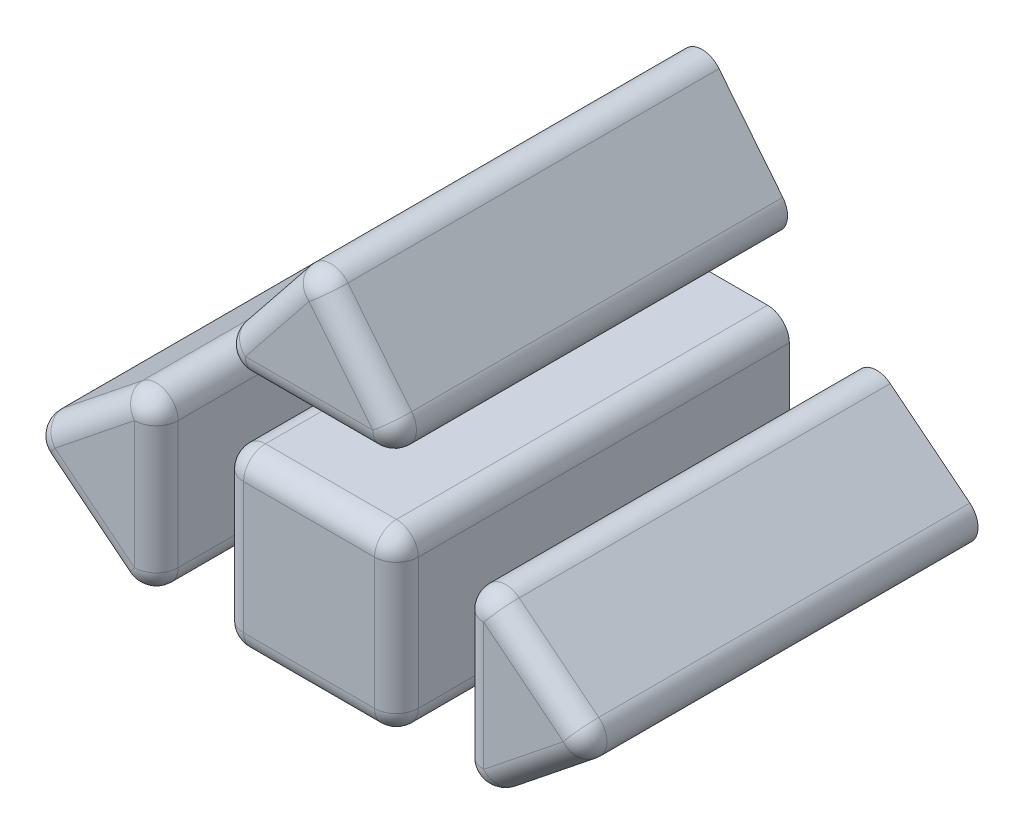
from build123d import *

# Parameters (mm, degrees)
BOSS_EXTRUDE1_DEPTH   = 18
BOSS_EXTRUDE1_2_DEPTH = 18
BOSS_EXTRUDE1_3_DEPTH = 18
BOSS_EXTRUDE1_4_DEPTH = 18
FILLET1_R             = 1
FILLET2_R             = 1
FILLET3_R             = 1
FILLET4_R             = 1


with BuildPart() as part:
    # Sketch1 → Boss-Extrude1 (new body)
    with BuildSketch(Plane.XY):
        with BuildLine():
            Line((-0.78062475, 12.269997998), (-3.69895875, 8.625))
            ThreePointArc((-3.69895875, 8.625), (-3.819721819, 7.566987298), (-2.918334001, 7))
            Line((-2.918334001, 7), (2.918334001, 7))
            ThreePointArc((2.918334001, 7), (3.819721819, 7.566987298), (3.69895875, 8.625))
            Line((3.69895875, 8.625), (0.78062475, 12.269997998))
            ThreePointArc((0.78062475, 12.269997998), (0, 12.644997998), (-0.78062475, 12.269997998))
        make_face()
    extrude(amount=BOSS_EXTRUDE1_DEPTH)

    # Fillet1
    fillet1_edges = [part.edges().sort_by_distance(p)[0] for p in [
        (0, 12.644997998, 18),
        (-2.23979175, 10.447498999, 18),
        (-3.819721819, 7.566987298, 18),
        (0, 7, 18),
        (3.819721819, 7.566987298, 18),
        (2.23979175, 10.447498999, 18),
    ]]
    fillet(fillet1_edges, radius=FILLET1_R)


with BuildPart() as body_2:
    # Sketch1 → Boss-Extrude1 2 (new body)
    with BuildSketch(Plane.XY):
        with BuildLine():
            Line((8.625, -3.69895875), (12.269997998, -0.78062475))
            ThreePointArc((12.269997998, -0.78062475), (12.644997998, 0), (12.269997998, 0.78062475))
            Line((12.269997998, 0.78062475), (8.625, 3.69895875))
            ThreePointArc((8.625, 3.69895875), (7.566987298, 3.819721819), (7, 2.918334001))
            Line((7, 2.918334001), (7, -2.918334001))
            ThreePointArc((7, -2.918334001), (7.566987298, -3.819721819), (8.625, -3.69895875))
        make_face()
    extrude(amount=BOSS_EXTRUDE1_2_DEPTH)

    # Fillet4
    fillet4_edges = [body_2.edges().sort_by_distance(p)[0] for p in [
        (12.644997998, 0, 18),
        (10.447498999, 2.23979175, 18),
        (7.566987298, 3.819721819, 18),
        (7, 0, 18),
        (7.566987298, -3.819721819, 18),
        (10.447498999, -2.23979175, 18),
    ]]
    fillet(fillet4_edges, radius=FILLET4_R)


with BuildPart() as body_3:
    # Sketch1 → Boss-Extrude1 3 (new body)
    with BuildSketch(Plane.XY):
        with BuildLine():
            Line((-3, -4), (3, -4))
            ThreePointArc((3, -4), (3.707106781, -3.707106781), (4, -3))
            Line((4, -3), (4, 3))
            ThreePointArc((4, 3), (3.707106781, 3.707106781), (3, 4))
            Line((3, 4), (-3, 4))
            ThreePointArc((-3, 4), (-3.707106781, 3.707106781), (-4, 3))
            Line((-4, 3), (-4, -3))
            ThreePointArc((-4, -3), (-3.707106781, -3.707106781), (-3, -4))
        make_face()
    extrude(amount=BOSS_EXTRUDE1_3_DEPTH)

    # Fillet3
    fillet3_edges = [body_3.edges().sort_by_distance(p)[0] for p in [
        (3.707106781, -3.707106781, 18),
        (4, 0, 18),
        (3.707106781, 3.707106781, 18),
        (0, 4, 18),
        (-3.707106781, 3.707106781, 18),
        (-4, 0, 18),
        (-3.707106781, -3.707106781, 18),
        (0, -4, 18),
    ]]
    fillet(fillet3_edges, radius=FILLET3_R)


with BuildPart() as body_4:
    # Sketch1 → Boss-Extrude1 4 (new body)
    with BuildSketch(Plane.XY):
        with BuildLine():
            Line((-8.625, 3.69895875), (-12.269997998, 0.78062475))
            ThreePointArc((-12.269997998, 0.78062475), (-12.644997998, 0), (-12.269997998, -0.78062475))
            Line((-12.269997998, -0.78062475), (-8.625, -3.69895875))
            ThreePointArc((-8.625, -3.69895875), (-7.566987298, -3.819721819), (-7, -2.918334001))
            Line((-7, -2.918334001), (-7, 2.918334001))
            ThreePointArc((-7, 2.918334001), (-7.566987298, 3.819721819), (-8.625, 3.69895875))
        make_face()
    extrude(amount=BOSS_EXTRUDE1_4_DEPTH)

    # Fillet2
    fillet2_edges = [body_4.edges().sort_by_distance(p)[0] for p in [
        (-7.566987298, 3.819721819, 18),
        (-10.447498999, 2.23979175, 18),
        (-12.644997998, 0, 18),
        (-10.447498999, -2.23979175, 18),
        (-7.566987298, -3.819721819, 18),
        (-7, 0, 18),
    ]]
    fillet(fillet2_edges, radius=FILLET2_R)


solid = Compound([part.part, body_2.part, body_3.part, body_4.part])
